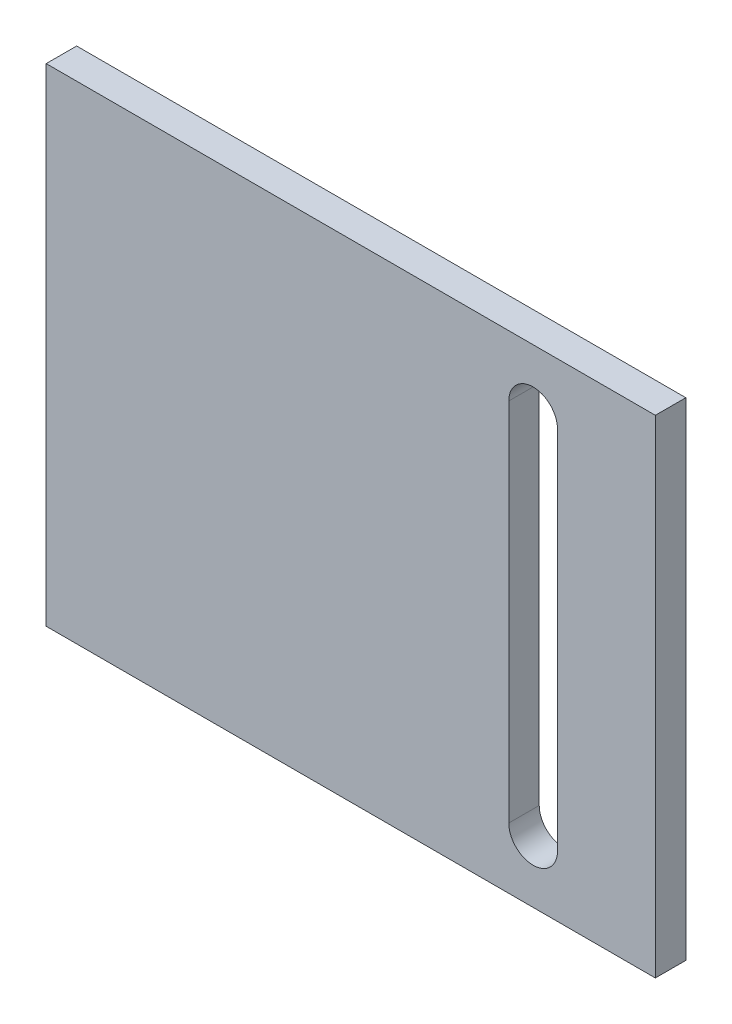
from build123d import *

# Parameters (mm, degrees)
SKETCH1_W           = 100
SKETCH1_H           = 80
BOSS_EXTRUDE1_DEPTH = 5


with BuildPart() as part:
    # Sketch1 → Boss-Extrude1 (new body)
    with BuildSketch(Plane.XY):
        with Locations((44.051446945, -3.006430868)):
            Rectangle(SKETCH1_W, SKETCH1_H)
        with BuildLine():
            Line((77.987138264, 26.993569132), (77.987138264, -33.006430868))
            ThreePointArc((77.987138264, -33.006430868), (73.987138264, -37.006430868), (69.987138264, -33.006430868))
            Line((69.987138264, -33.006430868), (69.987138264, 26.993569132))
            ThreePointArc((69.987138264, 26.993569132), (73.987138264, 30.993569132), (77.987138264, 26.993569132))
        make_face(mode=Mode.SUBTRACT)
    extrude(amount=BOSS_EXTRUDE1_DEPTH)


solid = part.part
